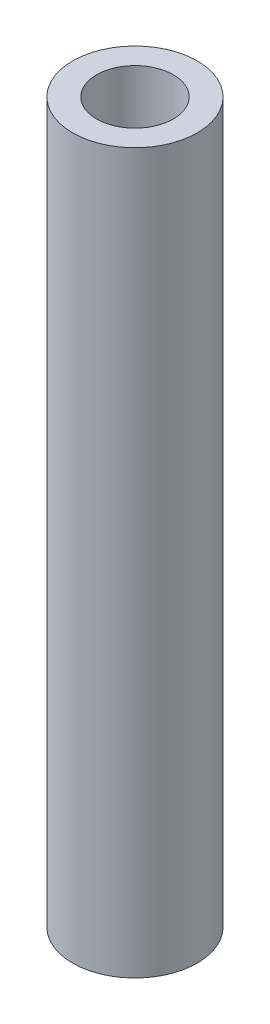
from build123d import *

# Parameters (mm, degrees)
SKETCH1_R           = 2.6
SKETCH1_R_2         = 1.6
BOSS_EXTRUDE1_DEPTH = 30


with BuildPart() as part:
    # Sketch1 → Boss-Extrude1 (new body)
    with BuildSketch(Plane(origin=(0, 3, 0), x_dir=(1, 0, 0), z_dir=(0, 1, 0))):
        with Locations(Location((-20, 25, 0), (0, 0, 270))):
            Circle(SKETCH1_R)
        with Locations(Location((-20, 25, 0), (0, 0, 270))):
            Circle(SKETCH1_R_2, mode=Mode.SUBTRACT)
    extrude(amount=BOSS_EXTRUDE1_DEPTH)


solid = part.part
